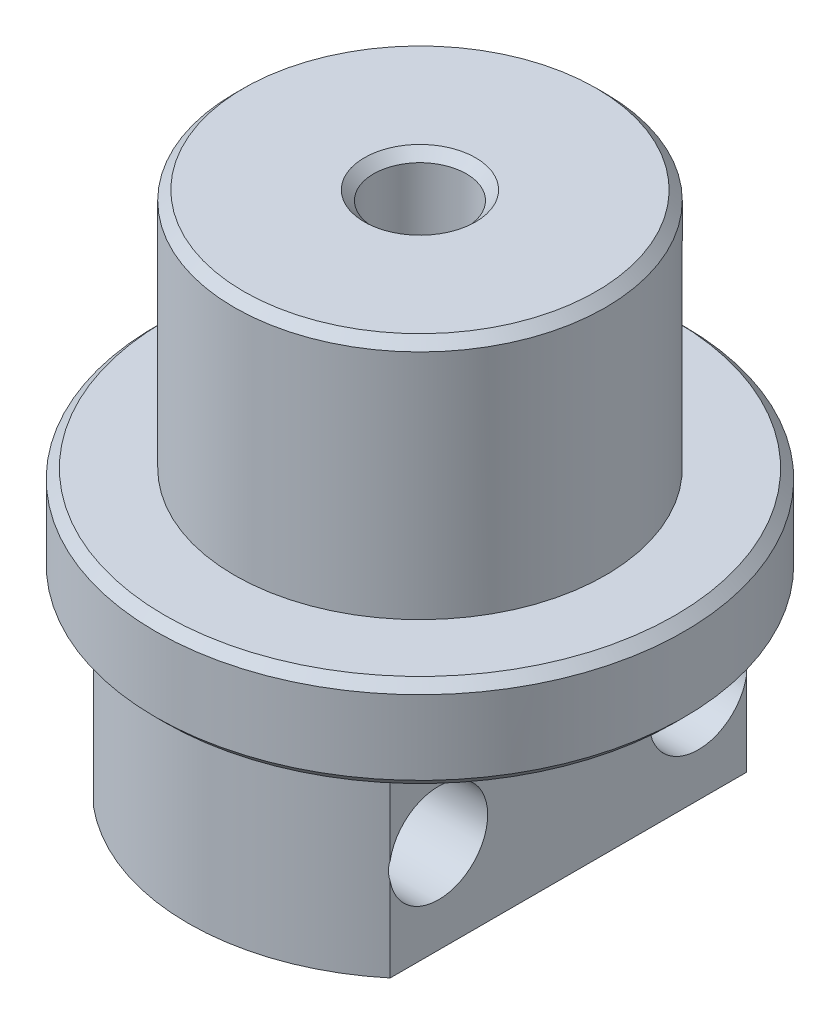
from build123d import *

# Parameters (mm, degrees)
WYTNIJ_WYCI_GNI_CIE1_DEPTH                        = 10
POG_BIENIE_WALCOWE_POD_M5_RUB_Z_BEM_W_D           = 5.3
POG_BIENIE_WALCOWE_POD_M5_RUB_Z_BEM_W_DEPTH       = 60
POG_BIENIE_WALCOWE_POD_M5_RUB_Z_BEM_W_CBORE_D     = 10
POG_BIENIE_WALCOWE_POD_M5_RUB_Z_BEM_W_CBORE_DEPTH = 5
POG_BIENIE_WALCOWE_POD_M5_RUB_Z_BEM_W_TIP         = 1.59228064
OTWORY_USTALAJ_CE_5_0MM1_D                        = 5
SFAZOWANIE1_SIZE                                  = 0.5


with BuildPart() as part:
    # Szkic1 → Obrót1 (revolve)
    with BuildSketch(Plane.XY, mode=Mode.PRIVATE) as obr_t1_sk:
        Polygon((0, 0), (0, 28), (10, 28), (10, 15), (14.25, 15), (14.25, 10), (12.5, 10), (12.5, 0), align=None)
    revolve(obr_t1_sk.sketch.rotate(Axis((0, 0, 0), (0, -1, 0)), 90), axis=Axis((0, 0, 0), (0, -1, 0)))

    # Szkic2 → Wytnij-wyciągnięcie1 (cut)
    with BuildSketch(Plane(origin=(0, 0, 0), x_dir=(-1, 0, 0), z_dir=(0, -1, 0))):
        with BuildLine():
            Line((-8, -9.604686356), (-8, 9.604686356))
            ThreePointArc((-8, 9.604686356), (-12.5, 0), (-8, -9.604686356))
        make_face()
        with BuildLine():
            Line((8, -9.604686356), (8, 9.604686356))
            ThreePointArc((8, 9.604686356), (12.5, 0), (8, -9.604686356))
        make_face()
    extrude(amount=-WYTNIJ_WYCI_GNI_CIE1_DEPTH, mode=Mode.SUBTRACT)

    # Pogłębienie walcowe pod M5 Śrubę z łbem walcowym z gniazdem
    with Locations(Plane(origin=(24.5, 33, -156.349537134), x_dir=(-2.1969032495960934e-12, 0, -1.0), z_dir=(1.0, 0, -2.1969032495960934e-12))):
        with Locations((-163.349537134, -28), (-149.349537134, -28)):
            CounterBoreHole(POG_BIENIE_WALCOWE_POD_M5_RUB_Z_BEM_W_D / 2, POG_BIENIE_WALCOWE_POD_M5_RUB_Z_BEM_W_CBORE_D / 2, POG_BIENIE_WALCOWE_POD_M5_RUB_Z_BEM_W_CBORE_DEPTH, depth=POG_BIENIE_WALCOWE_POD_M5_RUB_Z_BEM_W_DEPTH)
            with Locations((0, 0, -(POG_BIENIE_WALCOWE_POD_M5_RUB_Z_BEM_W_DEPTH + POG_BIENIE_WALCOWE_POD_M5_RUB_Z_BEM_W_TIP / 2))):  # 118° drill point
                Cone(0, POG_BIENIE_WALCOWE_POD_M5_RUB_Z_BEM_W_D / 2, POG_BIENIE_WALCOWE_POD_M5_RUB_Z_BEM_W_TIP, mode=Mode.SUBTRACT)

    # Otwory ustalające Ø5.0mm1 (through all)
    with Locations(Plane(origin=(0, 28, 0), x_dir=(1, 0, 0), z_dir=(0, 1, 0))):
        with Locations((0, 0)):
            Hole(OTWORY_USTALAJ_CE_5_0MM1_D / 2)

    # Sfazowanie1
    sfazowanie1_edges = [part.edges().sort_by_distance(p)[0] for p in [
        (2.5, 28, 0),
        (0, 10, -14.25),
        (0, 15, -14.25),
        (0, 28, -10),
    ]]
    chamfer(sfazowanie1_edges, length=SFAZOWANIE1_SIZE)


solid = part.part
